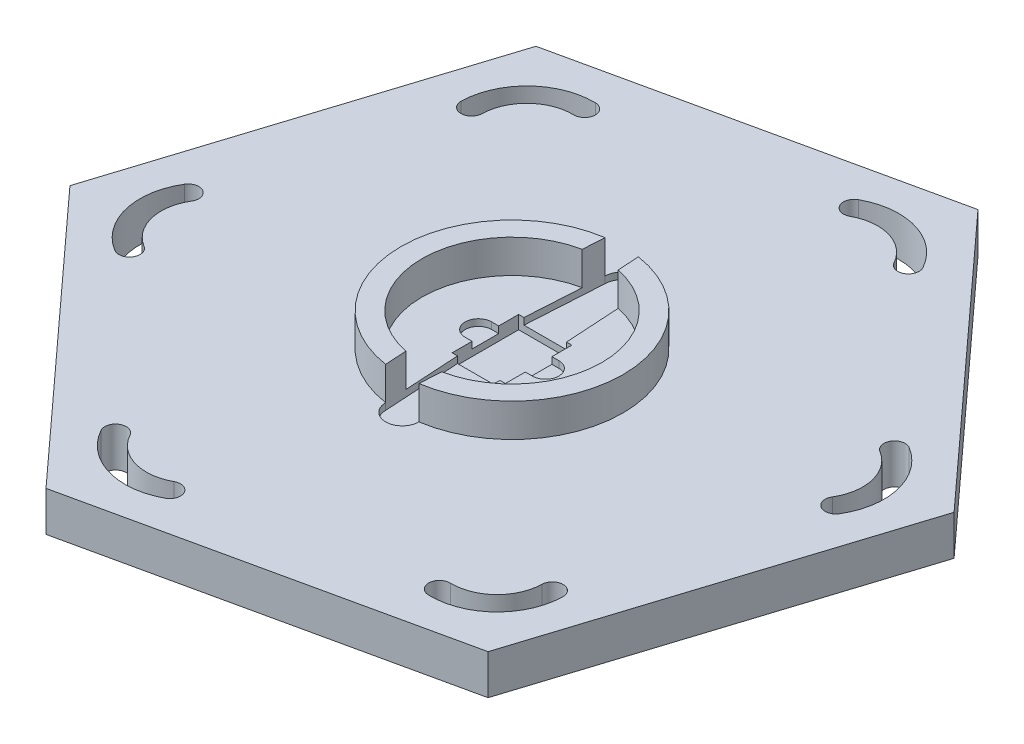
from build123d import *

# Parameters (mm, degrees)
BOSS_EXTRU_1_DEPTH      = 6
ESQUISSE2_W             = 8
ESQUISSE2_H             = 10
ENL_V_MAT_EXTRU_1_DEPTH = 2
ENL_V_MAT_EXTRU_2_DEPTH = 1
ENL_V_MAT_EXTRU_3_DEPTH = 1
BOSS_EXTRU_2_DEPTH      = 5
ENL_V_MAT_EXTRU_4_DEPTH = 6


with BuildPart() as part:
    # Esquisse1 → Boss.-Extru.1 (new body)
    with BuildSketch(Plane(origin=(0, 0, 0), x_dir=(1, 0, 0), z_dir=(0, 1, 0))):
        Polygon((-37.62183883, 41.220449501), (-54.508875838, -11.971243414), (-16.887037008, -53.191692914), (37.62183883, -41.220449501), (54.508875838, 11.971243414), (16.887037008, 53.191692914), align=None)
    extrude(amount=BOSS_EXTRU_1_DEPTH)

    # Esquisse2 → Enlèv. mat.-Extru.1 (cut)
    with BuildSketch(Plane(origin=(0, 6, 0), x_dir=(1, 0, 0), z_dir=(0, 1, 0))):
        Rectangle(ESQUISSE2_W, ESQUISSE2_H)
    extrude(amount=-ENL_V_MAT_EXTRU_1_DEPTH, mode=Mode.SUBTRACT)

    # Esquisse5 → Enlèv. mat.-Extru.2 (cut)
    with BuildSketch(Plane(origin=(0, 6, 0), x_dir=(1, 0, 0), z_dir=(0, 1, 0))):
        with BuildLine():
            Line((-2.5, 16.5), (-3.5, 0))
            Line((-3.5, 0), (-2.5, -16.5))
            ThreePointArc((-2.5, -16.5), (0, -19), (2.5, -16.5))
            Line((2.5, -16.5), (3.5, 0))
            Line((3.5, 0), (2.5, 16.5))
            ThreePointArc((2.5, 16.5), (0, 19), (-2.5, 16.5))
        make_face()
    extrude(amount=-ENL_V_MAT_EXTRU_2_DEPTH, mode=Mode.SUBTRACT)

    # Esquisse6 → Enlèv. mat.-Extru.3 (cut)
    with BuildSketch(Plane(origin=(0, 6, 0), x_dir=(1, 0, 0), z_dir=(0, 1, 0))):
        with BuildLine():
            Line((-5.05, 2), (5.05, 2))
            ThreePointArc((5.05, 2), (7.05, 0), (5.05, -2))
            Line((5.05, -2), (-5.05, -2))
            ThreePointArc((-5.05, -2), (-7.05, 0), (-5.05, 2))
        make_face()
    extrude(amount=-ENL_V_MAT_EXTRU_3_DEPTH, mode=Mode.SUBTRACT)

    # Esquisse7 → Boss.-Extru.2 (add)
    with BuildSketch(Plane(origin=(0, 6, 0), x_dir=(1, 0, 0), z_dir=(0, 1, 0))):
        with BuildLine():
            Line((-2.5, 16.5), (-2.696377272, 13.259775018))
            ThreePointArc((-2.696377272, 13.259775018), (-13.53115235, 0), (-2.696377272, -13.259775018))
            Line((-2.696377272, -13.259775018), (-2.5, -16.5))
            ThreePointArc((-2.5, -16.5), (-16.688319268, 0), (-2.5, 16.5))
        make_face()
        with BuildLine():
            Line((2.5, 16.5), (2.696377272, 13.259775018))
            ThreePointArc((2.696377272, 13.259775018), (13.53115235, 0), (2.696377272, -13.259775018))
            Line((2.696377272, -13.259775018), (2.5, -16.5))
            ThreePointArc((2.5, -16.5), (16.688319268, 0), (2.5, 16.5))
        make_face()
    extrude(amount=BOSS_EXTRU_2_DEPTH)

    # Esquisse8 → Enlèv. mat.-Extru.4 (cut)
    with BuildSketch(Plane(origin=(0, 6, 0), x_dir=(1, 0, 0), z_dir=(0, 1, 0))):
        with BuildLine():
            ThreePointArc((-46.080402753, -3.15609697), (-47.261935037, -10.79446929), (-42.696259662, -17.031083645))
            ThreePointArc((-42.696259662, -17.031083645), (-40.497960079, -16.494913015), (-41.034130709, -14.296613432))
            ThreePointArc((-41.034130709, -14.296613432), (-44.153069953, -10.036209514), (-43.345932541, -4.818225923))
            ThreePointArc((-43.345932541, -4.818225923), (-43.882103171, -2.61992634), (-46.080402753, -3.15609697))
        make_face()
        with BuildLine():
            ThreePointArc((-25.773461529, 38.328750916), (-32.979252144, 35.532801729), (-36.097480922, 28.460503691))
            ThreePointArc((-36.097480922, 28.460503691), (-34.533993744, 26.824805722), (-32.898295775, 28.3882929))
            ThreePointArc((-32.898295775, 28.3882929), (-30.768147373, 33.219575477), (-25.845672321, 35.12956577))
            ThreePointArc((-25.845672321, 35.12956577), (-24.209974352, 36.693052947), (-25.773461529, 38.328750916))
        make_face()
        with BuildLine():
            ThreePointArc((20.306941224, 41.484847886), (14.282682893, 46.327271019), (6.59877874, 45.491587336))
            ThreePointArc((6.59877874, 45.491587336), (5.963966335, 43.319718738), (8.135834934, 42.684906333))
            ThreePointArc((8.135834934, 42.684906333), (13.38492258, 43.255784991), (17.50026022, 39.947791692))
            ThreePointArc((17.50026022, 39.947791692), (19.672128819, 39.312979287), (20.306941224, 41.484847886))
        make_face()
        with BuildLine():
            ThreePointArc((46.080402753, 3.15609697), (47.261935037, 10.79446929), (42.696259662, 17.031083645))
            ThreePointArc((42.696259662, 17.031083645), (40.497960079, 16.494913015), (41.034130709, 14.296613432))
            ThreePointArc((41.034130709, 14.296613432), (44.153069953, 10.036209514), (43.345932541, 4.818225923))
            ThreePointArc((43.345932541, 4.818225923), (43.882103171, 2.61992634), (46.080402753, 3.15609697))
        make_face()
        with BuildLine():
            ThreePointArc((25.773461529, -38.328750916), (32.979252144, -35.532801729), (36.097480922, -28.460503691))
            ThreePointArc((36.097480922, -28.460503691), (34.533993744, -26.824805722), (32.898295775, -28.3882929))
            ThreePointArc((32.898295775, -28.3882929), (30.768147373, -33.219575477), (25.845672321, -35.12956577))
            ThreePointArc((25.845672321, -35.12956577), (24.209974352, -36.693052947), (25.773461529, -38.328750916))
        make_face()
        with BuildLine():
            ThreePointArc((-20.306941224, -41.484847886), (-14.282682893, -46.327271019), (-6.59877874, -45.491587336))
            ThreePointArc((-6.59877874, -45.491587336), (-5.963966335, -43.319718738), (-8.135834934, -42.684906333))
            ThreePointArc((-8.135834934, -42.684906333), (-13.38492258, -43.255784991), (-17.50026022, -39.947791692))
            ThreePointArc((-17.50026022, -39.947791692), (-19.672128819, -39.312979287), (-20.306941224, -41.484847886))
        make_face()
    extrude(amount=-ENL_V_MAT_EXTRU_4_DEPTH, mode=Mode.SUBTRACT)


solid = part.part
